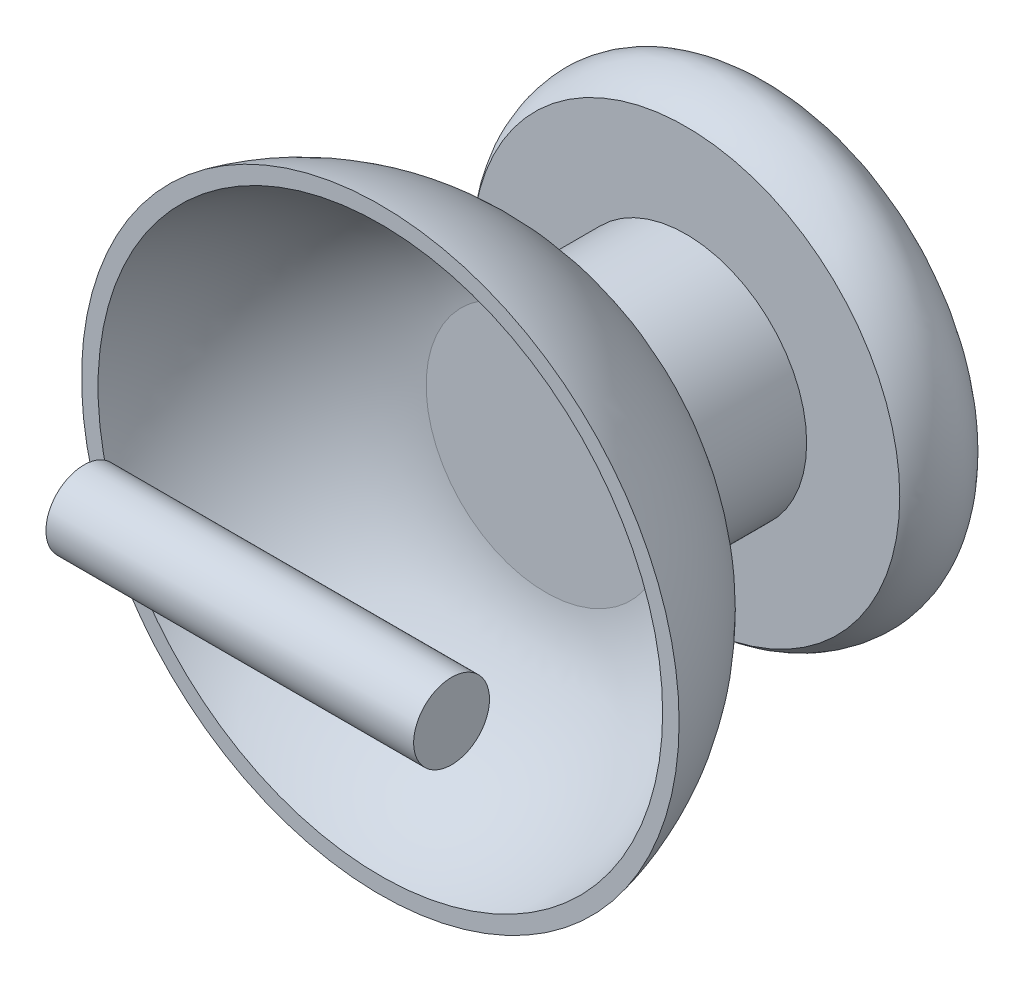
from build123d import *

# Parameters (mm, degrees)
SHELL1_T            = -0.7
SKETCH2_R           = 5.25
BOSS_EXTRUDE1_DEPTH = 5.4
SKETCH4_R           = 1.65
BOSS_EXTRUDE2_DEPTH = 8


with BuildPart() as part:
    # Sketch1 → Revolve1 (revolve)
    with BuildSketch(Plane(origin=(0, 0, 0), x_dir=(1, 0, 0), z_dir=(0, 1, 0))):
        with BuildLine():
            Line((-13, 0), (0, 0))
            Line((0, 0), (0, 7.9))
            Line((0, 7.9), (-5.25, 7.9))
            add(Edge.make_bspline(
                [(-5.25, 7.9), (-9.186458611, 7.430852086), (-12.235748674, 3.583812434), (-13, 0)],
                knots=[0, 0, 0, 0, 1, 1, 1, 1], degree=3))
        make_face()
    revolve(axis=Axis((0, 0, 0), (0, 0, -1)))

    # Shell1
    shell1_openings = [part.faces().sort_by_distance(p)[0] for p in [
        (0, 0, 0),
    ]]
    offset(amount=SHELL1_T, openings=shell1_openings, kind=Kind.INTERSECTION)

    # Sketch2 → Boss-Extrude1 (add)
    with BuildSketch(Plane(origin=(0, 0, -7.9), x_dir=(-1, 0, 0), z_dir=(0, 0, -1))):
        with Locations(Location((0, 0, 0), (0, 0, 180))):
            Circle(SKETCH2_R)
    extrude(amount=BOSS_EXTRUDE1_DEPTH)

    # Sketch3 → Revolve2 (revolve)
    with BuildSketch(Plane(origin=(0, 0, 0), x_dir=(1, 0, 0), z_dir=(0, 1, 0))):
        with BuildLine():
            Line((0, 13.3), (-9.3, 13.3))
            add(Edge.make_bspline(
                [(-9.3, 13.3), (-9.736235745, 13.755003631), (-10.224214241, 15.180437203), (-9.731031698, 16.308849724), (-8.021916977, 17.920792712), (-3.389077274, 18.6), (0, 18.6)],
                knots=[0, 0, 0, 0, 0.216854983, 0.411075257, 0.489389758, 1, 1, 1, 1], degree=3))
            Line((0, 18.6), (0, 13.3))
        make_face()
    revolve(axis=Axis((0, 0, 0), (0, 0, -1)))


with BuildPart() as body_2:
    # Sketch4 → Boss-Extrude2 (new, symmetric)
    with BuildSketch(Plane(origin=(0, 0, 0), x_dir=(0, 0, -1), z_dir=(1, 0, 0))):
        with Locations((-4.9, 0)):
            Circle(SKETCH4_R)
    extrude(amount=BOSS_EXTRUDE2_DEPTH, both=True)


solid = Compound([part.part, body_2.part])
